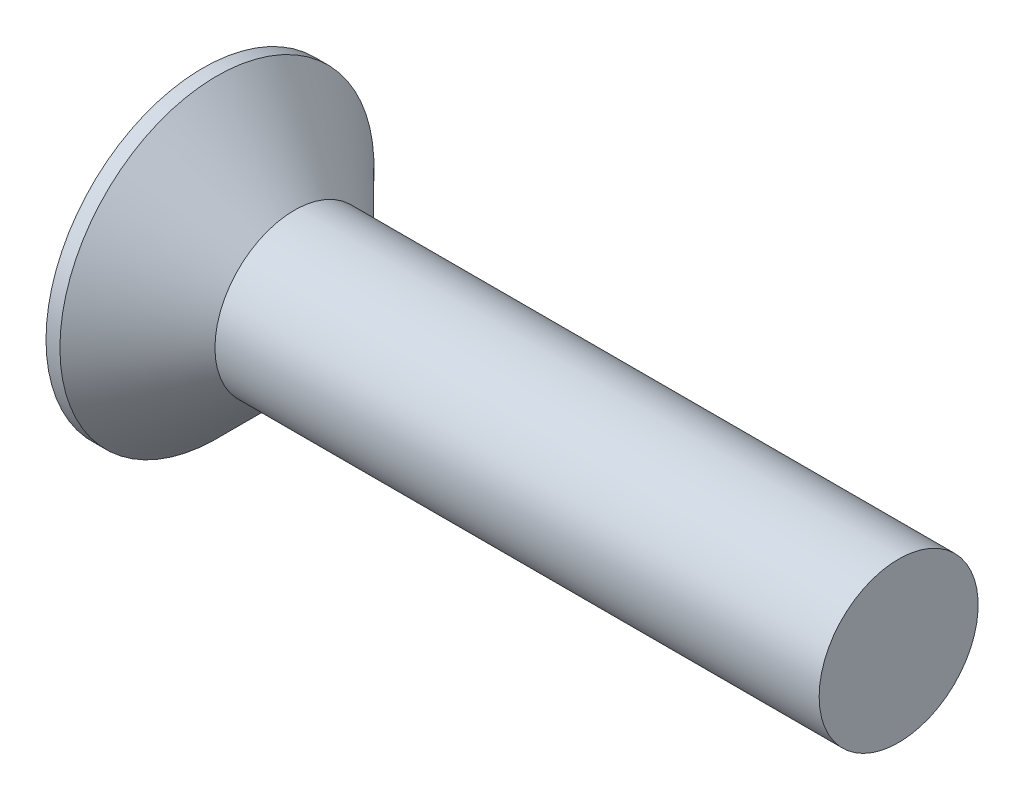
from build123d import *

# Parameters (mm, degrees)
CIRPATTERN1_COUNT = 2
CIRPATTERN1_ANGLE = 90


with BuildPart() as part:
    # BodySke → Base-Revolve (revolve)
    with BuildSketch(Plane.XY, mode=Mode.PRIVATE) as base_revolve_sk:
        Polygon((0, 0), (0, 7.9), (0.7, 7.9), (4.6, 4), (35, 4), (35, 0), align=None)
    revolve(base_revolve_sk.sketch.rotate(Axis((-6.35, 0, 0), (1, 0, 0)), 90), axis=Axis((-6.35, 0, 0), (1, 0, 0)))

    # Sketch3 → Cross section 0
    with BuildSketch(Plane.ZY):
        with BuildLine():
            Line((-0.9, 4.39), (0.9, 4.39))
            Line((0.9, 4.39), (0.9, -4.39))
            Line((0.9, -4.39), (-0.9, -4.39))
            Line((-0.9, -4.39), (-0.9, 4.39))
        make_face()
    # Sketch4 → Cross section 1
    with BuildSketch(Plane.ZY.offset(-4.88)):
        with BuildLine():
            Line((-0.45, 0.45), (0.45, 0.45))
            Line((0.45, 0.45), (0.45, -0.45))
            Line((0.45, -0.45), (-0.45, -0.45))
            Line((-0.45, -0.45), (-0.45, 0.45))
        make_face()
    cross = loft(mode=Mode.SUBTRACT)

    # CirPattern1: Cross ×2 about axis
    cirpattern1_axis = Axis((0, 0, 0), (1, 0, 0))
    for i in range(1, CIRPATTERN1_COUNT):
        add(cross.rotate(cirpattern1_axis, i * CIRPATTERN1_ANGLE / (CIRPATTERN1_COUNT - 1)), mode=Mode.SUBTRACT)


solid = part.part
